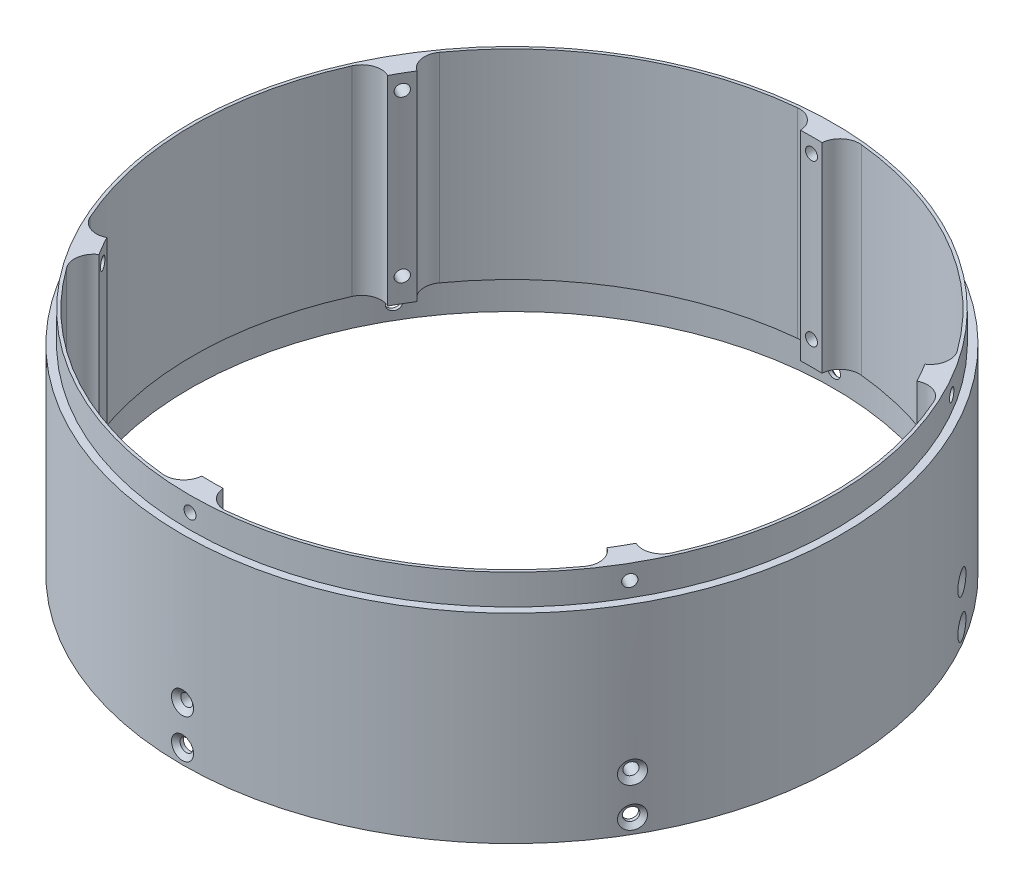
from build123d import *

# Parameters (mm, degrees)
CUT_EXTRUDE1_DEPTH                        = 133.15324891957826
CIRPATTERN1_COUNT                         = 6
TAPPED_HOLE_FOR_4_40_HELICOIL1_AT_2_COUNT = 2
TAPPED_HOLE_FOR_4_40_HELICOIL1_AT_2_PITCH = 40.894000000000005
CIRPATTERN2_COUNT                         = 6


with BuildPart() as part:
    # Sketch1 → Revolve1 (revolve)
    with BuildSketch(Plane.XY, mode=Mode.PRIVATE) as revolve1_sk:
        Polygon((76.2, -50.8), (76.20000000000003, 0), (81.88960000000003, 0), (81.88960000000003, -7.6708), (83.82000000000004, -7.670799999999989), (83.82000000000002, -58.419999999999995), (81.94040000000004, -58.419999999999995), (81.94040000000004, -50.79999999999999), align=None)
    revolve(revolve1_sk.sketch.rotate(Axis((0, 42.39510168777739, 0), (0, -1, 0)), 90), axis=Axis((0, 42.39510168777739, 0), (0, -1, 0)))

    # Sketch2 → Cut-Extrude1 (cut, through all)
    with BuildSketch(Plane(origin=(0, 0, 0), x_dir=(1, 0, 0), z_dir=(0, 1, 0))):
        with BuildLine():
            ThreePointArc((-8.128016987239903, 80.71940796125271), (-40.563800000000136, 70.25856254806241), (-65.8410493792649, 47.39877317396734))
            ThreePointArc((-65.8410493792649, 47.39877317396734), (-64.72088607812911, 40.52071256804154), (-57.842825472203295, 41.64087586917733))
            ThreePointArc((-57.842825472203295, 41.64087586917733), (-35.63620000000011, 61.72370898868599), (-7.140643602440563, 70.9137942201863))
            ThreePointArc((-7.140643602440563, 70.9137942201863), (-2.7315234243070465, 76.3102877831192), (-8.128016987239903, 80.71940796125271))
        make_face()
    cut_extrude1 = extrude(amount=-CUT_EXTRUDE1_DEPTH, mode=Mode.SUBTRACT)

    # CirPattern1: Cut-Extrude1 ×6 about axis
    cirpattern1_axis = Axis((-4.682e-14, 0, 2.819e-14), (0, 1, 0))
    for i in range(1, CIRPATTERN1_COUNT):
        add(cut_extrude1.rotate(cirpattern1_axis, i * 360 / CIRPATTERN1_COUNT), mode=Mode.SUBTRACT)

    # Sketch4 → Tapped Hole for #4-40 Helicoil1 (revolve, cut)
    with BuildSketch(Plane(origin=(0, -3.8099999999999996, 83.82), x_dir=(0, -1, 0), z_dir=(1, 0, 0))):
        Polygon((0, 0), (-6.45e-15, 26.315711583397988), (1.5239999999999854, 25.39999999999999), (1.5239999999999967, 1.1189393581749023), (2.8575, 0), align=None)
    tapped_hole_for_4_40_helicoil1 = revolve(axis=Axis((0, -3.8099999999999996, 90.16999999999999), (0, 0, -1)), mode=Mode.SUBTRACT)

    # Tapped Hole for #4-40 Helicoil1 at 2: Tapped Hole for #4-40 Helicoil1 ×2
    with Locations(*[(0, -i * TAPPED_HOLE_FOR_4_40_HELICOIL1_AT_2_PITCH, 0) for i in range(1, TAPPED_HOLE_FOR_4_40_HELICOIL1_AT_2_COUNT)]):
        add(tapped_hole_for_4_40_helicoil1, mode=Mode.SUBTRACT)

    # Sketch6 → CSK for #4 Flat Head Machine Screw (100)1 (revolve, cut)
    with BuildSketch(Plane(origin=(4.7e-16, -54.61000000000001, 83.82), x_dir=(0, -1, 0), z_dir=(1, 0, 0))):
        Polygon((0, 0), (-6.45e-15, 26.380574487222027), (1.6319499999999938, 25.4), (1.631949999999997, 1.0283585529893176), (2.8575, 0), align=None)
    csk_for_4_flat_head_machine_screw_100 = revolve(axis=Axis((4.7e-16, -54.61000000000001, 90.16999999999999), (0, 0, -1)), mode=Mode.SUBTRACT)

    # CirPattern2: Tapped Hole for #4-40 Helicoil1, CSK for #4 Flat Head Machine Screw (100)1 ×6 about axis
    cirpattern2_axis = Axis((0, 42.39510168777739, 0), (0, 1, 0))
    add([tapped_hole_for_4_40_helicoil1.rotate(cirpattern2_axis, i * 360 / CIRPATTERN2_COUNT) for i in range(1, CIRPATTERN2_COUNT)], mode=Mode.SUBTRACT)
    add([csk_for_4_flat_head_machine_screw_100.rotate(cirpattern2_axis, i * 360 / CIRPATTERN2_COUNT) for i in range(1, CIRPATTERN2_COUNT)], mode=Mode.SUBTRACT)

    # CirPattern2 copy 1 sketch → CirPattern2 copy 1 (revolve, cut)
    with BuildSketch(Plane(origin=(72.59024934521163, -44.70400000000001, 41.910000000000004), x_dir=(0, -1, 0), z_dir=(0.5000000000000001, 0, -0.8660254037844386))):
        Polygon((0, 0), (-6.45e-15, 26.315711583397988), (1.5239999999999854, 25.39999999999999), (1.5239999999999967, 1.1189393581749023), (2.8575, 0), align=None)
    revolve(axis=Axis((78.08951065924282, -44.70400000000001, 45.085), (-0.8660254037844386, 0, -0.5000000000000001)), mode=Mode.SUBTRACT)

    # CirPattern2 copy 2 sketch → CirPattern2 copy 2 (revolve, cut)
    with BuildSketch(Plane(origin=(72.59024934521165, -44.70400000000001, -41.909999999999975), x_dir=(0, -1, 0), z_dir=(-0.4999999999999998, 0, -0.8660254037844387))):
        Polygon((0, 0), (-6.45e-15, 26.315711583397988), (1.5239999999999854, 25.39999999999999), (1.5239999999999967, 1.1189393581749023), (2.8575, 0), align=None)
    revolve(axis=Axis((78.08951065924283, -44.70400000000001, -45.08499999999997), (-0.8660254037844387, 0, 0.4999999999999998)), mode=Mode.SUBTRACT)

    # CirPattern2 copy 3 sketch → CirPattern2 copy 3 (revolve, cut)
    with BuildSketch(Plane(origin=(1.026e-14, -44.70400000000001, -83.82), x_dir=(0, -1, 0), z_dir=(-1, 0, -1.2e-16))):
        Polygon((0, 0), (-6.45e-15, 26.315711583397988), (1.5239999999999854, 25.39999999999999), (1.5239999999999967, 1.1189393581749023), (2.8575, 0), align=None)
    revolve(axis=Axis((1.104e-14, -44.70400000000001, -90.16999999999999), (-1.2e-16, 0, 1)), mode=Mode.SUBTRACT)

    # CirPattern2 copy 4 sketch → CirPattern2 copy 4 (revolve, cut)
    with BuildSketch(Plane(origin=(-72.59024934521162, -44.70400000000001, -41.91000000000003), x_dir=(0, -1, 0), z_dir=(-0.5000000000000004, 0, 0.8660254037844384))):
        Polygon((0, 0), (-6.45e-15, 26.315711583397988), (1.5239999999999854, 25.39999999999999), (1.5239999999999967, 1.1189393581749023), (2.8575, 0), align=None)
    revolve(axis=Axis((-78.08951065924279, -44.70400000000001, -45.085000000000036), (0.8660254037844384, 0, 0.5000000000000004)), mode=Mode.SUBTRACT)

    # CirPattern2 copy 5 sketch → CirPattern2 copy 5 (revolve, cut)
    with BuildSketch(Plane(origin=(-72.59024934521163, -44.70400000000001, 41.910000000000004), x_dir=(0, -1, 0), z_dir=(0.5000000000000001, 0, 0.8660254037844386))):
        Polygon((0, 0), (-6.45e-15, 26.315711583397988), (1.5239999999999854, 25.39999999999999), (1.5239999999999967, 1.1189393581749023), (2.8575, 0), align=None)
    revolve(axis=Axis((-78.08951065924282, -44.70400000000001, 45.085), (0.8660254037844386, 0, -0.5000000000000001)), mode=Mode.SUBTRACT)


solid = part.part
